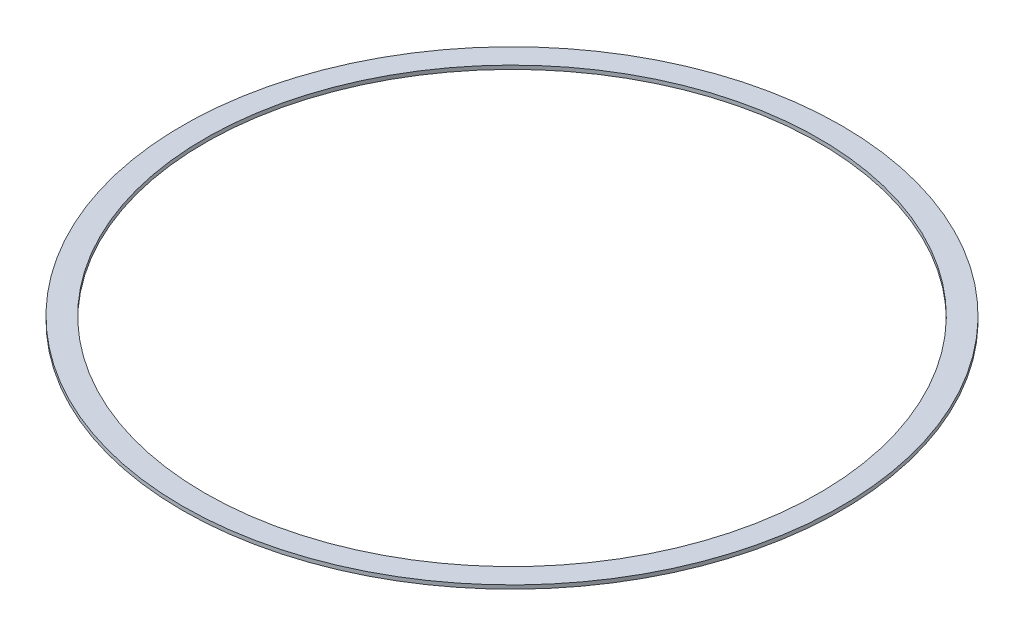
from build123d import *

# Parameters (mm, degrees)
SKETCH1_R           = 223.8248
SKETCH1_R_2         = 208.5848
BOSS_EXTRUDE1_DEPTH = 2.54


with BuildPart() as part:
    # Sketch1 → Boss-Extrude1 (new body)
    with BuildSketch(Plane(origin=(0, 0, 0), x_dir=(1, 0, 0), z_dir=(0, 1, 0))):
        with Locations(Location((0, 0, 0), (0, 0, 270))):
            Circle(SKETCH1_R)
        with Locations(Location((0, 0, 0), (0, 0, 270))):
            Circle(SKETCH1_R_2, mode=Mode.SUBTRACT)
    extrude(amount=BOSS_EXTRUDE1_DEPTH)


solid = part.part
